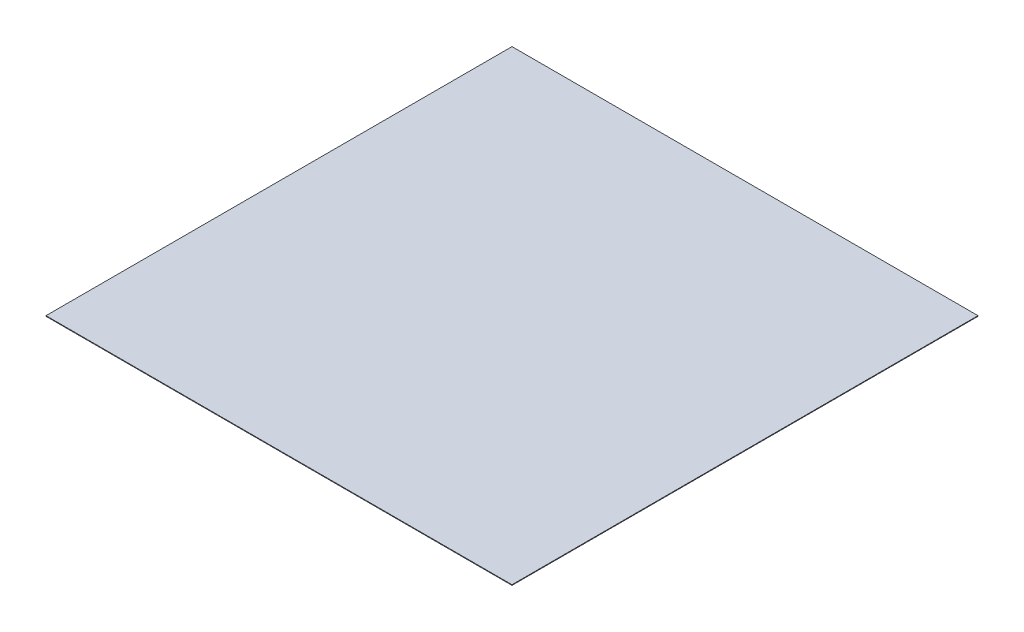
from build123d import *

# Parameters (mm, degrees)
BOSS_EXTRUDE1_DEPTH      = 457.2
BOSS_EXTRUDE1_DEPTH_BACK = 457.2
SKETCH3_W                = 914.4
SKETCH3_H                = 1.1938


with BuildPart() as part:
    # Sketch3 → Boss-Extrude1 (new, two sides: drawn at the far end of the back side and taken through both)
    with BuildSketch(Plane.XY.offset(-BOSS_EXTRUDE1_DEPTH_BACK)):
        Rectangle(SKETCH3_W, SKETCH3_H)
    extrude(amount=BOSS_EXTRUDE1_DEPTH + BOSS_EXTRUDE1_DEPTH_BACK)


solid = part.part
